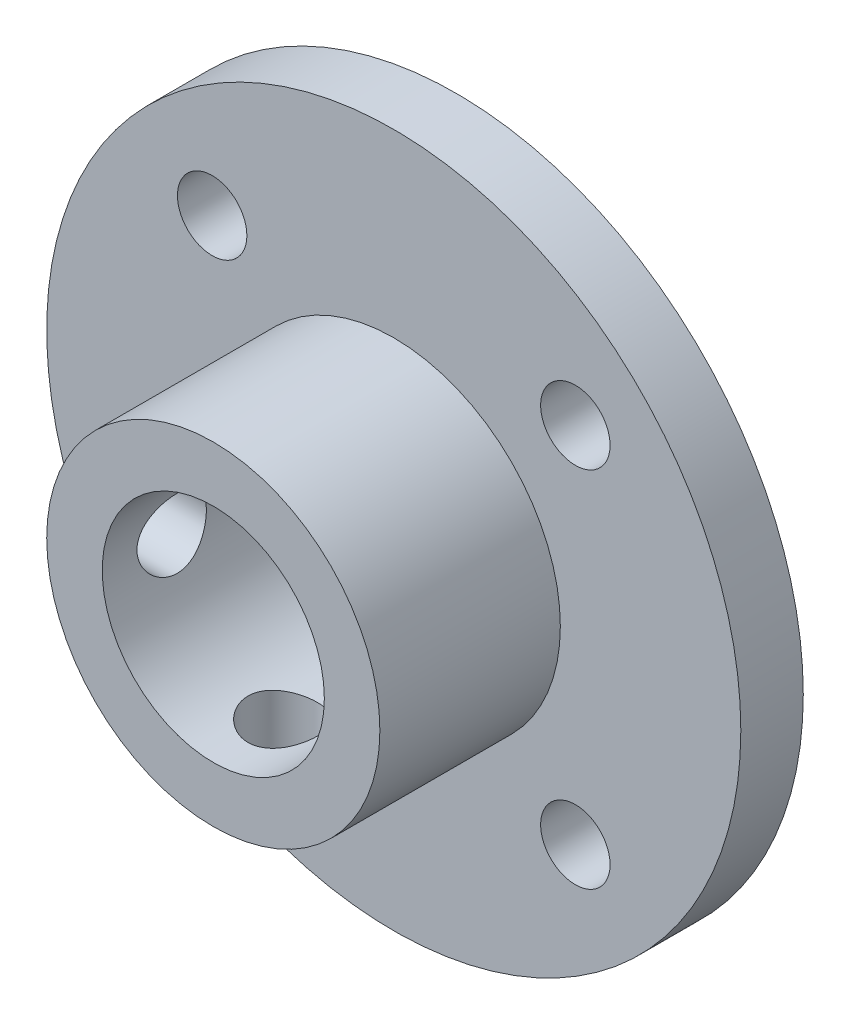
from build123d import *

# Parameters (mm, degrees)
SKETCH_1_R          = 25
SKETCH_1_R_2        = 8
SKETCH_1_R_3        = 2.5
EXTRUDE_1_DEPTH     = 4.5
SKETCH_2_R          = 12
SKETCH_2_R_2        = 8
EXTRUDE_2_DEPTH     = 13
SKETCH_3_R          = 2.5
CUT_EXTRUDE_1_DEPTH = 26
SKETCH_5_R          = 2.5
CUT_EXTRUDE_4_DEPTH = 26


with BuildPart() as part:
    # 草图1 → 凸台-拉伸1 (new body)
    with BuildSketch(Plane.XY):
        Circle(SKETCH_1_R)
        Circle(SKETCH_1_R_2, mode=Mode.SUBTRACT)
        with Locations((13.081475452, 13.081475452)):
            Circle(SKETCH_1_R_3, mode=Mode.SUBTRACT)
        with Locations((13.081475452, -13.081475452)):
            Circle(SKETCH_1_R_3, mode=Mode.SUBTRACT)
        with Locations((-13.081475452, -13.081475452)):
            Circle(SKETCH_1_R_3, mode=Mode.SUBTRACT)
        with Locations((-13.081475452, 13.081475452)):
            Circle(SKETCH_1_R_3, mode=Mode.SUBTRACT)
    extrude(amount=EXTRUDE_1_DEPTH)

    # 草图2 → 凸台-拉伸2 (add)
    with BuildSketch(Plane.XY.offset(4.5)):
        with Locations(Location((0, 0, 0), (0, 0, 180))):
            Circle(SKETCH_2_R)
        Circle(SKETCH_2_R_2, mode=Mode.SUBTRACT)
    extrude(amount=EXTRUDE_2_DEPTH)

    # 草图3 → 切除-拉伸1 (cut)
    with BuildSketch(Plane(origin=(0, 0, 0), x_dir=(1, 0, 0), z_dir=(0, 1, 0))):
        with Locations(Location((0, -12.5, 0), (0, 0, 270))):
            Circle(SKETCH_3_R)
    extrude(amount=-CUT_EXTRUDE_1_DEPTH, mode=Mode.SUBTRACT)

    # 草图5 → 切除-拉伸4 (cut)
    with BuildSketch(Plane(origin=(0, 0, 0), x_dir=(0, 0, -1), z_dir=(1, 0, 0))):
        with Locations(Location((-12.5, 0, 0), (0, 0, 180))):
            Circle(SKETCH_5_R)
    extrude(amount=-CUT_EXTRUDE_4_DEPTH, mode=Mode.SUBTRACT)


solid = part.part
